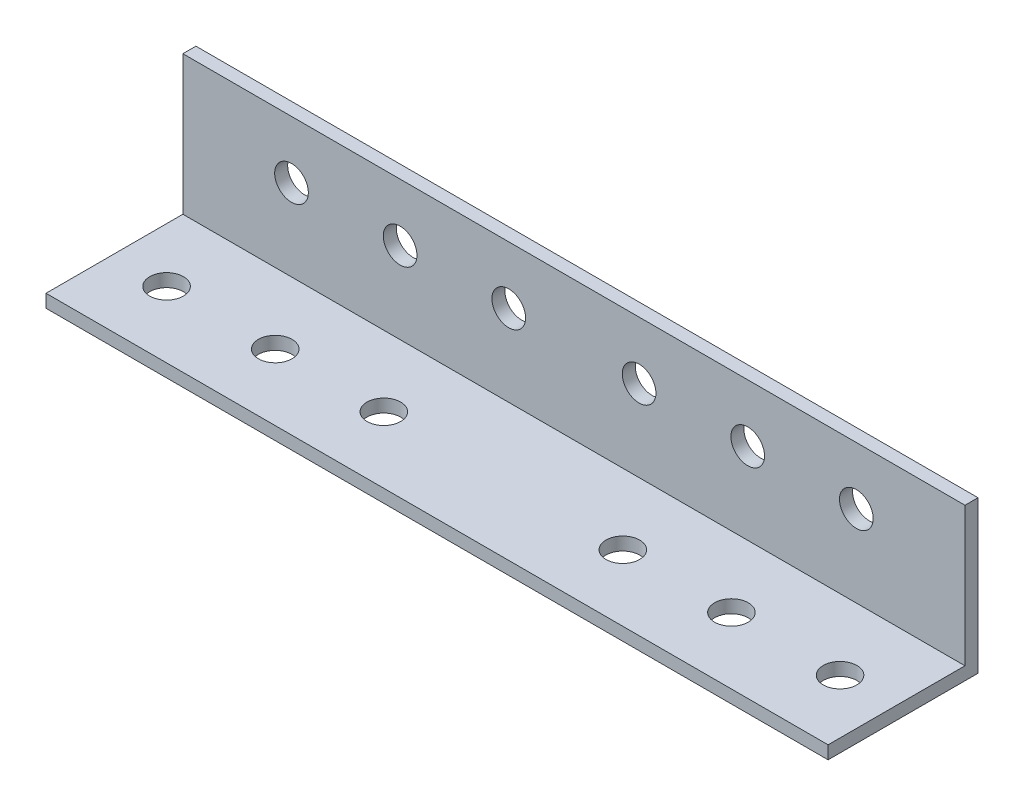
from build123d import *

# Parameters (mm, degrees)
SKETCH1_W      = 720
SKETCH1_H      = 140
SKETCH1_R      = 15.5
EXTRUDE1_DEPTH = 12
SKETCH2_W      = 720
SKETCH2_H      = 12
EXTRUDE2_DEPTH = 126
SKETCH3_R      = 15.5
EXTRUDE3_DEPTH = 168


with BuildPart() as part:
    # Sketch1 → Extrude1 (new body)
    with BuildSketch(Plane.XY):
        with Locations((360, 70)):
            Rectangle(SKETCH1_W, SKETCH1_H)
        with Locations((100, 87)):
            Circle(SKETCH1_R, mode=Mode.SUBTRACT)
        with Locations((200, 87)):
            Circle(SKETCH1_R, mode=Mode.SUBTRACT)
        with Locations((300, 87)):
            Circle(SKETCH1_R, mode=Mode.SUBTRACT)
        with Locations((520, 87)):
            Circle(SKETCH1_R, mode=Mode.SUBTRACT)
        with Locations((620, 87)):
            Circle(SKETCH1_R, mode=Mode.SUBTRACT)
        with Locations((420, 87)):
            Circle(SKETCH1_R, mode=Mode.SUBTRACT)
    extrude(amount=EXTRUDE1_DEPTH)

    # Sketch2 → Extrude2 (add)
    with BuildSketch(Plane.XY.offset(12)):
        with Locations((360, 6)):
            Rectangle(SKETCH2_W, SKETCH2_H)
    extrude(amount=EXTRUDE2_DEPTH)

    # Sketch3 → Extrude3 (cut)
    with BuildSketch(Plane(origin=(0, 12, 0), x_dir=(1, 0, 0), z_dir=(0, 1, 0))):
        with Locations(Location((50, -77, 0), (0, 0, 270))):
            Circle(SKETCH3_R)
        with Locations(Location((150, -77, 0), (0, 0, 270))):
            Circle(SKETCH3_R)
        with Locations(Location((250, -77, 0), (0, 0, 270))):
            Circle(SKETCH3_R)
        with Locations(Location((670, -77, 0), (0, 0, 270))):
            Circle(SKETCH3_R)
        with Locations(Location((470, -77, 0), (0, 0, 270))):
            Circle(SKETCH3_R)
        with Locations(Location((570, -77, 0), (0, 0, 270))):
            Circle(SKETCH3_R)
    extrude(amount=-EXTRUDE3_DEPTH, mode=Mode.SUBTRACT)


solid = part.part
